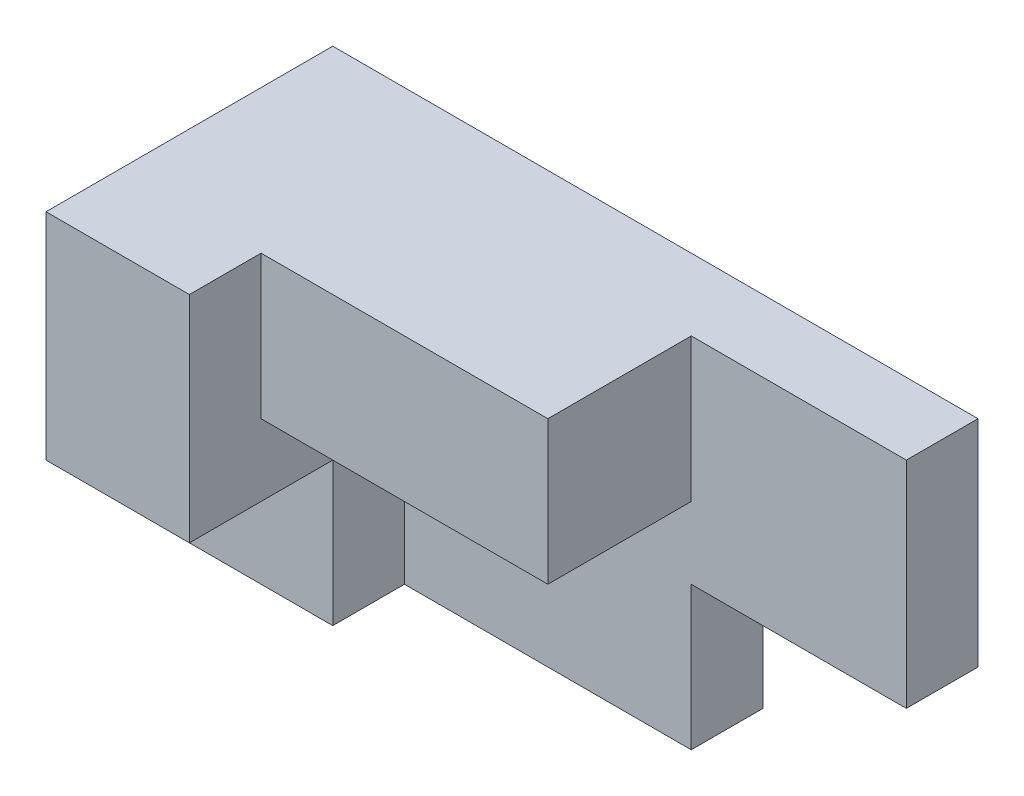
from build123d import *

# Parameters (mm, degrees)
BOSS_EXTRUDE2_DEPTH = 10
SKETCH2_6_W         = 20
SKETCH2_6_H         = 20
BOSS_EXTRUDE5_DEPTH = 20
SKETCH2_7_W         = 40
SKETCH2_7_H         = 20
BOSS_EXTRUDE6_DEPTH = 30
BOSS_EXTRUDE7_DEPTH = 40


with BuildPart() as part:
    # Sketch2 → Boss-Extrude2 (new body)
    with BuildSketch(Plane.XY):
        Polygon((0, 0), (60, 0), (60, 20), (90, 20), (90, 50), (0, 50), align=None)
    extrude(amount=BOSS_EXTRUDE2_DEPTH)

    # Sketch2<6> → Boss-Extrude5 (add)
    with BuildSketch(Plane.XY):
        with Locations((10, 10)):
            Rectangle(SKETCH2_6_W, SKETCH2_6_H)
    extrude(amount=BOSS_EXTRUDE5_DEPTH)

    # Sketch2<7> → Boss-Extrude6 (add)
    with BuildSketch(Plane.XY):
        with Locations((40, 40)):
            Rectangle(SKETCH2_7_W, SKETCH2_7_H)
    extrude(amount=BOSS_EXTRUDE6_DEPTH)

    # Sketch2<8> → Boss-Extrude7 (add)
    with BuildSketch(Plane.XY):
        Polygon((0, 50), (0, 20), (20, 20), (20, 30), (20, 50), align=None)
    extrude(amount=BOSS_EXTRUDE7_DEPTH)


solid = part.part
